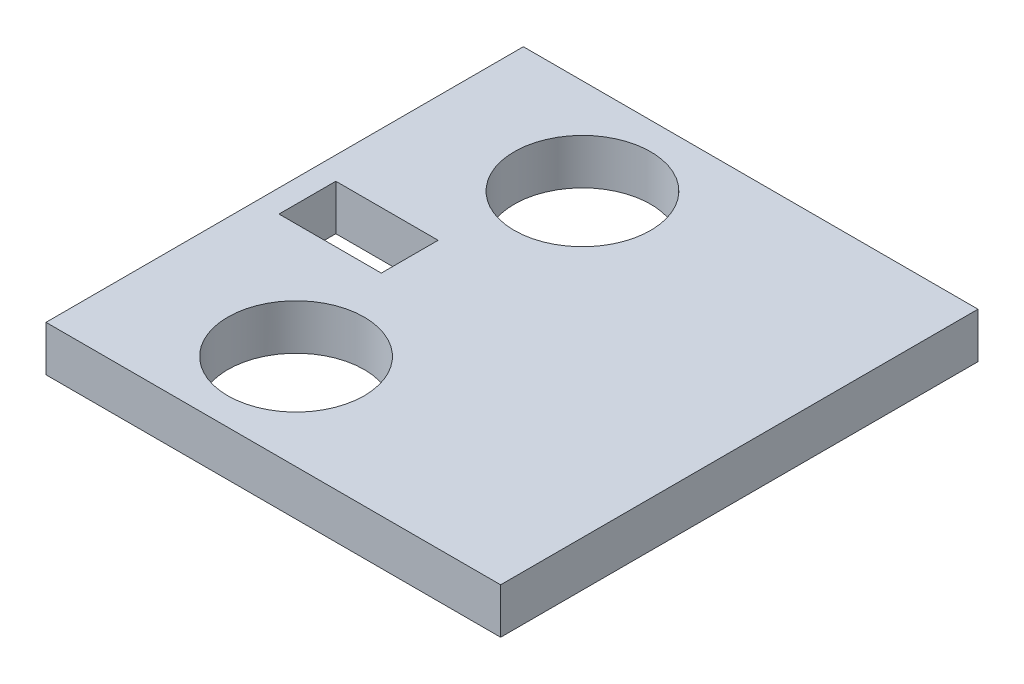
from build123d import *

# Parameters (mm, degrees)
SKETCH2_W           = 100
SKETCH2_H           = 105
BOSS_EXTRUDE1_DEPTH = 10
CUT_EXTRUDE1_REACH  = 75.186
SKETCH5_R           = 15
SKETCH5_R_2         = 5
CUT_EXTRUDE2_REACH  = 75.186
SKETCH6_W           = 22.5
SKETCH6_H           = 12.5


with BuildPart() as part:
    # Sketch2 → Boss-Extrude1 (new body)
    with BuildSketch(Plane(origin=(0, 0, 0), x_dir=(1, 0, 0), z_dir=(0, 1, 0))):
        Rectangle(SKETCH2_W, SKETCH2_H)
    extrude(amount=BOSS_EXTRUDE1_DEPTH)

    # Sketch5 → Cut-Extrude1 (cut, up to next)
    with BuildSketch(Plane.XZ, mode=Mode.PRIVATE) as cut_extrude1_sk1:
        with Locations(Location((-16.005435425, 31.5, 0), (0, 0, 270))):
            Circle(SKETCH5_R)
    cut_extrude1_tool1 = extrude(cut_extrude1_sk1.sketch, amount=-CUT_EXTRUDE1_REACH, mode=Mode.PRIVATE) & part.part
    # Sketch5 → Cut-Extrude1 (cut, up to next)
    with BuildSketch(Plane.XZ, mode=Mode.PRIVATE) as cut_extrude1_sk2:
        with Locations(Location((-39, 0, 0), (0, 0, 270))):
            Circle(SKETCH5_R_2)
    cut_extrude1_tool2 = extrude(cut_extrude1_sk2.sketch, amount=-CUT_EXTRUDE1_REACH, mode=Mode.PRIVATE) & part.part
    cut_extrude1_1 = cut_extrude1_tool1.solids().sort_by_distance((-16.005435, 0, 31.5))[0]
    add(cut_extrude1_1, mode=Mode.SUBTRACT)
    cut_extrude1_2 = cut_extrude1_tool2.solids().sort_by_distance((-39, 0, 0))[0]
    add(cut_extrude1_2, mode=Mode.SUBTRACT)
    cut_extrude1 = cut_extrude1_1 + cut_extrude1_2  # Cut-Extrude1 as one shape, for the pattern or mirror that repeats it

    # Mirror1: Cut-Extrude1 across plane
    add(cut_extrude1.mirror(Plane.XY), mode=Mode.SUBTRACT)

    # Sketch6 → Cut-Extrude2 (cut, up to next)
    with BuildSketch(Plane.XZ, mode=Mode.PRIVATE) as cut_extrude2_sk1:
        with Locations((-33.75, 0)):
            Rectangle(SKETCH6_W, SKETCH6_H)
    cut_extrude2_tool1 = extrude(cut_extrude2_sk1.sketch, amount=-CUT_EXTRUDE2_REACH, mode=Mode.PRIVATE) & part.part
    add(cut_extrude2_tool1.solids().sort_by_distance((-33.75, 0, 0))[0], mode=Mode.SUBTRACT)


solid = part.part
